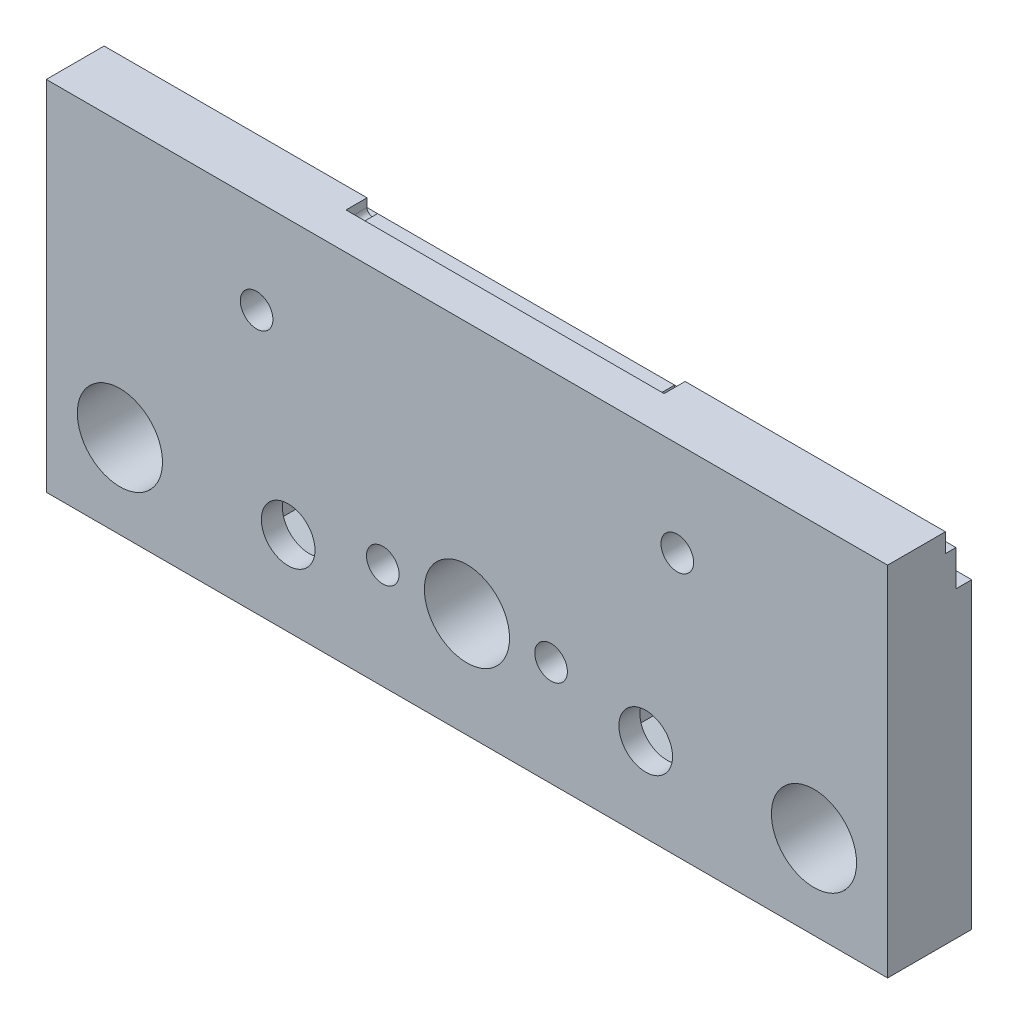
from build123d import *

# Parameters (mm, degrees)
SKETCH_2_W           = 80
SKETCH_2_H           = 34
SKETCH_2_R           = 4.05
EXTRUDE_1_DEPTH      = 8
SKETCH_3_R           = 2.55
CUT_EXTRUDE_1_DEPTH  = 88.292611371
CUT_EXTRUDE_2_DEPTH  = 88.292611371
SKETCH_5_R           = 1.55
CUT_EXTRUDE_3_DEPTH  = 88.292611371
CUT_EXTRUDE_5_DEPTH  = 4.5
SKETCH_11_R          = 1.55
CUT_EXTRUDE_7_DEPTH  = 88.292611371
CUT_EXTRUDE_11_DEPTH = 2
CUT_EXTRUDE_13_DEPTH = 6


with BuildPart() as part:
    # 草图2 → 凸台-拉伸1 (new body)
    with BuildSketch(Plane.XY):
        with Locations((40, 17)):
            Rectangle(SKETCH_2_W, SKETCH_2_H)
        with Locations((7, 8)):
            Circle(SKETCH_2_R, mode=Mode.SUBTRACT)
        with Locations((40, 10)):
            Circle(SKETCH_2_R, mode=Mode.SUBTRACT)
        with Locations((73, 8)):
            Circle(SKETCH_2_R, mode=Mode.SUBTRACT)
    extrude(amount=EXTRUDE_1_DEPTH)

    # 草图3 → 切除-拉伸1 (cut, through all)
    with BuildSketch(Plane.XY.offset(8)):
        with Locations((23, 8)):
            Circle(SKETCH_3_R)
        with Locations((57, 8)):
            Circle(SKETCH_3_R)
    extrude(amount=-CUT_EXTRUDE_1_DEPTH, mode=Mode.SUBTRACT)

    # 草图4 → 切除-拉伸2 (cut, through all)
    with BuildSketch(Plane(origin=(80, 0, 0), x_dir=(0, 0, -1), z_dir=(1, 0, 0))):
        Polygon((-1.5, 32.2), (-2.5, 32.2), (-2.5, 34), (0, 34), (0, 28.8), (-1.5, 28.8), align=None)
    extrude(amount=-CUT_EXTRUDE_2_DEPTH, mode=Mode.SUBTRACT)

    # 草图5 → 切除-拉伸3 (cut, through all)
    with BuildSketch(Plane.XY.offset(8)):
        with Locations((48, 10)):
            Circle(SKETCH_5_R)
        with Locations((32, 10)):
            Circle(SKETCH_5_R)
    extrude(amount=-CUT_EXTRUDE_3_DEPTH, mode=Mode.SUBTRACT)

    # 草图8 → 切除-拉伸5 (cut)
    with BuildSketch(Plane(origin=(0, 0, 0), x_dir=(-1, 0, 0), z_dir=(0, 0, -1))):
        Polygon((-45.15, 8.354551733), (-45.15, 11.645448267), (-48, 13.290896534), (-50.85, 11.645448267), (-50.85, 8.354551733), (-48, 6.709103466), align=None)
        Polygon((-29.15, 8.354551733), (-29.15, 11.645448267), (-32, 13.290896534), (-34.85, 11.645448267), (-34.85, 8.354551733), (-32, 6.709103466), align=None)
    extrude(amount=-CUT_EXTRUDE_5_DEPTH, mode=Mode.SUBTRACT)

    # 草图11 → 切除-拉伸7 (cut, through all)
    with BuildSketch(Plane(origin=(0, 0, 0), x_dir=(-1, 0, 0), z_dir=(0, 0, -1))):
        with Locations((-60, 25)):
            Circle(SKETCH_11_R)
        with Locations((-20, 25)):
            Circle(SKETCH_11_R)
    extrude(amount=-CUT_EXTRUDE_7_DEPTH, mode=Mode.SUBTRACT)

    # 草图19 → 切除-拉伸11 (cut)
    with BuildSketch(Plane(origin=(0, 0, 2.5), x_dir=(-1, 0, 0), z_dir=(0, 0, -1))):
        with BuildLine():
            Line((-25, 34), (-55.247938178, 34))
            Line((-55.247938178, 34), (-55.247938178, 33.2))
            ThreePointArc((-55.247938178, 33.2), (-54.747938178, 32.7), (-54.247938178, 33.2))
            Line((-54.247938178, 33.2), (-26, 33.2))
            ThreePointArc((-26, 33.2), (-25.5, 32.7), (-25, 33.2))
            Line((-25, 33.2), (-25, 34))
        make_face()
    extrude(amount=-CUT_EXTRUDE_11_DEPTH, mode=Mode.SUBTRACT)

    # 草图7 → 切除-拉伸13 (cut)
    with BuildSketch(Plane(origin=(0, 0, 0), x_dir=(-1, 0, 0), z_dir=(0, 0, -1))):
        Polygon((-52.9, 5.632863896), (-52.9, 10.367136104), (-57, 12.734272207), (-61.1, 10.367136104), (-61.1, 5.632863896), (-57, 3.265727793), align=None)
        Polygon((-18.9, 5.632863896), (-18.9, 10.367136104), (-23, 12.734272207), (-27.1, 10.367136104), (-27.1, 5.632863896), (-23, 3.265727793), align=None)
    extrude(amount=-CUT_EXTRUDE_13_DEPTH, mode=Mode.SUBTRACT)


solid = part.part
